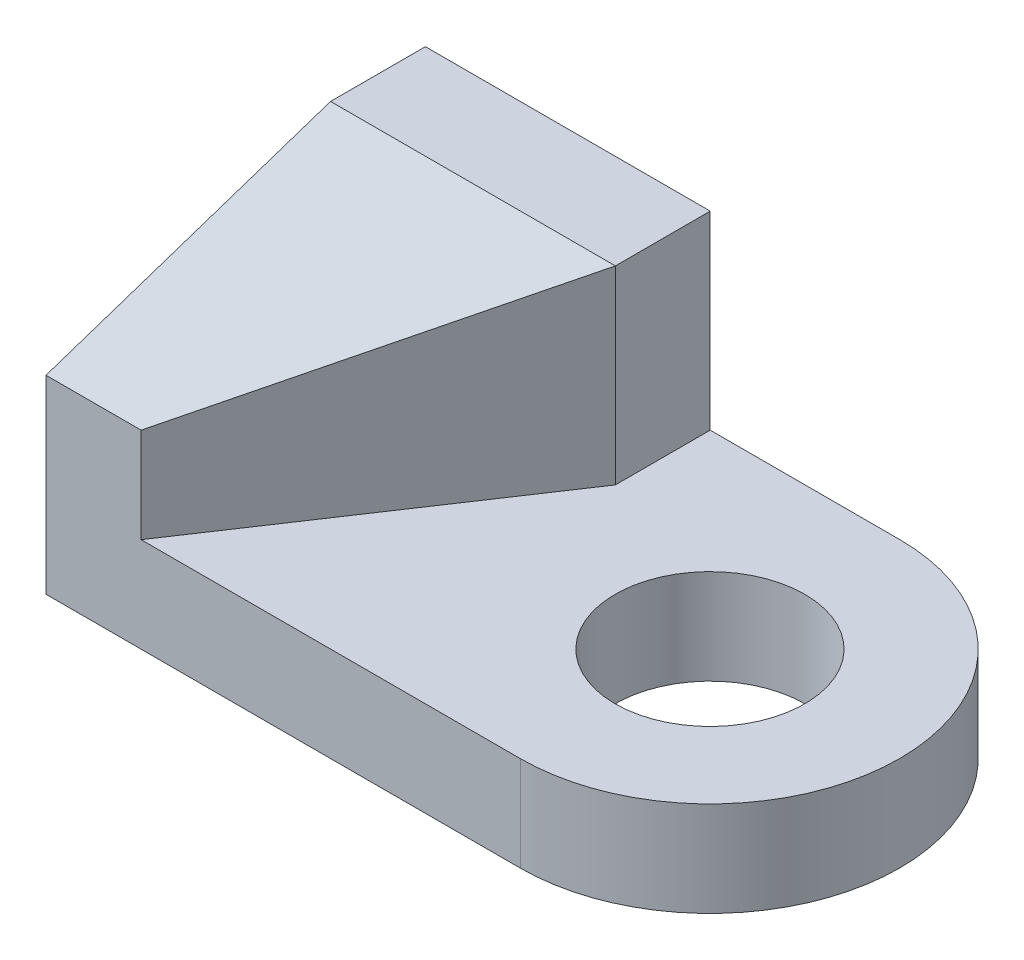
from build123d import *

# Parameters (mm, degrees)
SKETCH1_R           = 10
BOSS_EXTRUDE1_DEPTH = 10
SKETCH2_W           = 30.028941415
SKETCH2_H           = 40
BOSS_EXTRUDE2_DEPTH = 20
SKETCH3_OUTSIDE_W   = 59.204
SKETCH3_OUTSIDE_H   = 49.204
CUT_EXTRUDE1_DEPTH  = 36
CUT_EXTRUDE2_DEPTH  = 20


with BuildPart() as part:
    # Sketch1 → Boss-Extrude1 (new body)
    with BuildSketch(Plane(origin=(0, 0, 0), x_dir=(1, 0, 0), z_dir=(0, 1, 0))):
        with BuildLine():
            Line((0, 20), (-50, 20))
            Line((-50, 20), (-50, -20))
            Line((-50, -20), (0, -20))
            ThreePointArc((0, -20), (20, 0), (0, 20))
        make_face()
        with Locations(Location((0, 0, 0), (0, 0, 270))):
            Circle(SKETCH1_R, mode=Mode.SUBTRACT)
    extrude(amount=BOSS_EXTRUDE1_DEPTH)

    # Sketch2 → Boss-Extrude2 (add)
    with BuildSketch(Plane(origin=(0, 10, 0), x_dir=(1, 0, 0), z_dir=(0, 1, 0))):
        with Locations((-34.985529293, 0)):
            Rectangle(SKETCH2_W, SKETCH2_H)
    extrude(amount=BOSS_EXTRUDE2_DEPTH)

    # Sketch3 outside → Cut-Extrude1 (cut)
    with BuildSketch(Plane(origin=(-19.971058585, 0, 0), x_dir=(0, 0, -1), z_dir=(1, 0, 0))):
        with Locations((0, 15)):
            Rectangle(SKETCH3_OUTSIDE_W, SKETCH3_OUTSIDE_H)
        Polygon((20, 30), (10, 30), (-20, 20), (-20, 0), (20, 0), align=None, mode=Mode.SUBTRACT)
    extrude(amount=-CUT_EXTRUDE1_DEPTH, mode=Mode.SUBTRACT)

    # Sketch4 → Cut-Extrude2 (cut)
    with BuildSketch(Plane(origin=(0, 30, 0), x_dir=(1, 0, 0), z_dir=(0, 1, 0))):
        Polygon((-19.971058585, -20), (-19.971058585, 10), (-39.971058585, -20), align=None)
    extrude(amount=-CUT_EXTRUDE2_DEPTH, mode=Mode.SUBTRACT)


solid = part.part
